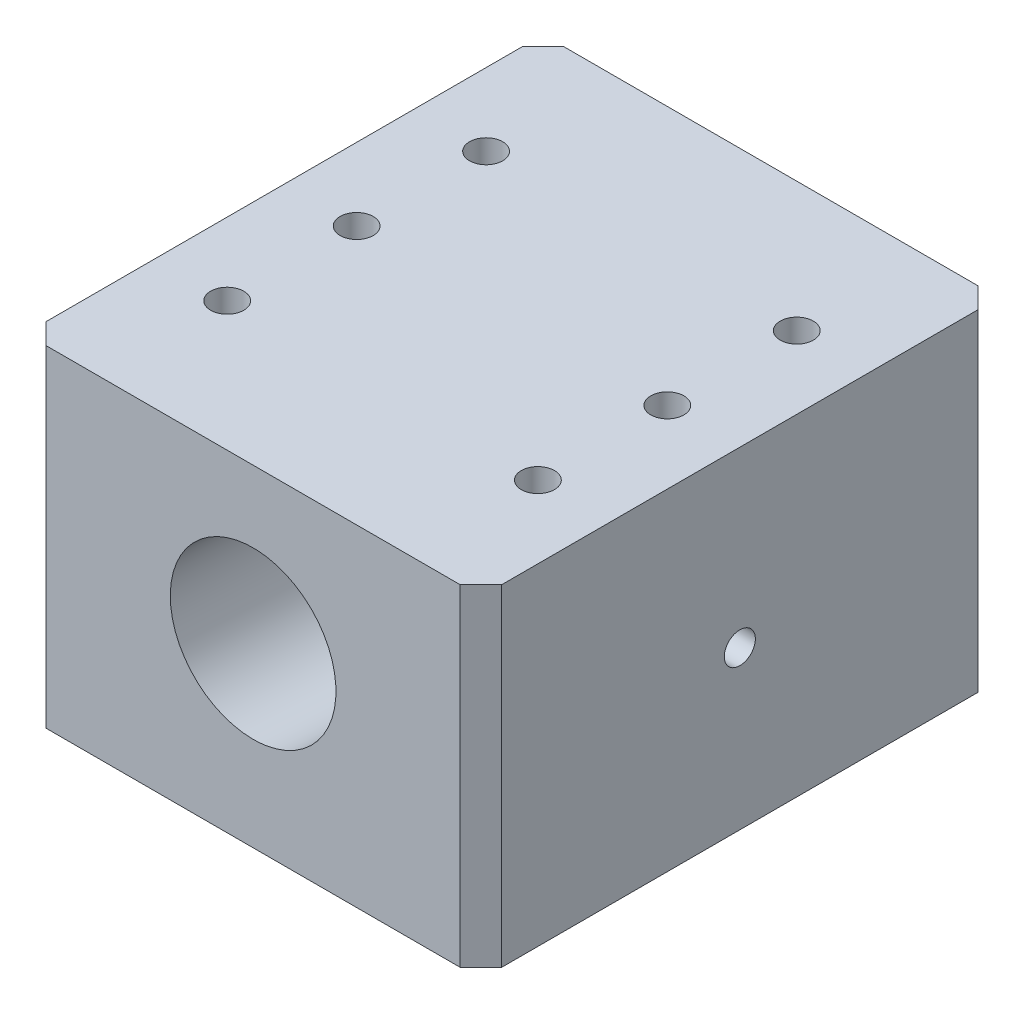
from build123d import *

# Parameters (mm, degrees)
IZIM1_W                     = 44
IZIM1_H                     = 32
Y_KSEKLIK_EKSTR_ZYON1_DEPTH = 50
KES_EKSTR_ZYON1_DEPTH       = 56
KES_EKSTR_ZYON1_DEPTH_BACK  = 60
IZIM2_R                     = 8
IZIM4_R                     = 1.6
KES_EKSTR_ZYON2_DEPTH       = 60
IZIM5_R                     = 1.5
KES_EKSTR_ZYON3_DEPTH       = 45
PAH1_SIZE                   = 2


with BuildPart() as part:
    # Çizim1 → Yükseklik-Ekstrüzyon1 (new body)
    with BuildSketch(Plane.XY):
        Rectangle(IZIM1_W, IZIM1_H)
    extrude(amount=-Y_KSEKLIK_EKSTR_ZYON1_DEPTH)

    # Çizim2 → Kes-Ekstrüzyon1 (cut, two sides: drawn at the far end of the back side and taken through both)
    with BuildSketch(Plane(origin=(0, 0.043824837, 0.836227706), x_dir=(-1, 0, 0), z_dir=(0, 0.05233595624294396, 0.998629534754574)).offset(-KES_EKSTR_ZYON1_DEPTH_BACK)):
        with Locations(Location((0, -1.08, 0), (0, 0, 90))):
            Circle(IZIM2_R)
    extrude(amount=KES_EKSTR_ZYON1_DEPTH + KES_EKSTR_ZYON1_DEPTH_BACK, mode=Mode.SUBTRACT)

    # Çizim4 → Kes-Ekstrüzyon2 (cut)
    with BuildSketch(Plane(origin=(0, 16, 0), x_dir=(1, 0, 0), z_dir=(0, 1, 0))):
        with Locations(Location((-15, 25, 0), (0, 0, 270))):
            Circle(IZIM4_R)
        with Locations(Location((-15, 37.5, 0), (0, 0, 270))):
            Circle(IZIM4_R)
        with Locations(Location((-15, 12.5, 0), (0, 0, 270))):
            Circle(IZIM4_R)
        with Locations(Location((15, 12.5, 0), (0, 0, 270))):
            Circle(IZIM4_R)
        with Locations(Location((15, 37.5, 0), (0, 0, 270))):
            Circle(IZIM4_R)
        with Locations(Location((15, 25, 0), (0, 0, 270))):
            Circle(IZIM4_R)
    extrude(amount=-KES_EKSTR_ZYON2_DEPTH, mode=Mode.SUBTRACT)

    # Çizim5 → Kes-Ekstrüzyon3 (cut, symmetric)
    with BuildSketch(Plane(origin=(0, 0, 0), x_dir=(0, 0, -1), z_dir=(1, 0, 0))):
        with Locations((25, -0.769453415)):
            Circle(IZIM5_R)
    extrude(amount=KES_EKSTR_ZYON3_DEPTH, both=True, mode=Mode.SUBTRACT)

    # Pah1
    pah1_edges = [part.edges().sort_by_distance(p)[0] for p in [
        (-22, 0, -50),
        (22, 0, -50),
        (-22, 0, 0),
        (22, 0, 0),
    ]]
    chamfer(pah1_edges, length=PAH1_SIZE)


solid = part.part
